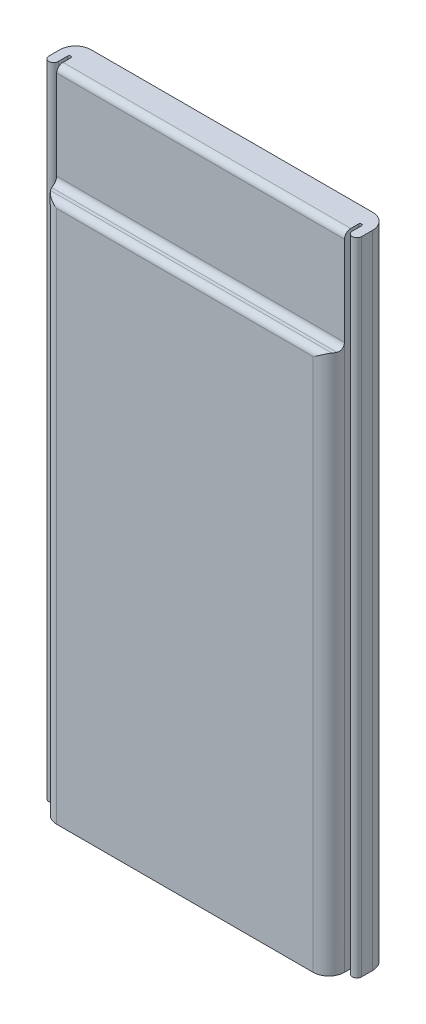
from build123d import *

# Parameters (mm, degrees)
EXTRUDE_1_DEPTH                 = 20.5
CUT_EXTRUDE_1_REACH             = 25.005
CUT_EXTRUDE_1_DIRECTION_2_REACH = 25.005


with BuildPart() as part:
    # Эскиз1 → Бобышка-Вытянуть1 (new, symmetric)
    with BuildSketch(Plane(origin=(0, 0, 0), x_dir=(1, 0, 0), z_dir=(0, 1, 0))):
        with BuildLine():
            Line((-9, 0), (9, 0))
            ThreePointArc((9, 0), (9.707106781, -0.292893219), (10, -1))
            Line((10, -1), (10, -1.7))
            ThreePointArc((10, -1.7), (9.7, -2), (9.4, -1.7))
            Line((9.4, -1.7), (9.4, -1.1))
            ThreePointArc((9.4, -1.1), (9.3, -1), (9.2, -1.1))
            Line((9.2, -1.1), (9.2, -2))
            ThreePointArc((9.2, -2), (8.907106781, -2.707106781), (8.2, -3))
            Line((8.2, -3), (-8.2, -3))
            ThreePointArc((-8.2, -3), (-8.907106781, -2.707106781), (-9.2, -2))
            Line((-9.2, -2), (-9.2, -1.1))
            ThreePointArc((-9.2, -1.1), (-9.3, -1), (-9.4, -1.1))
            Line((-9.4, -1.1), (-9.4, -1.7))
            ThreePointArc((-9.4, -1.7), (-9.7, -2), (-10, -1.7))
            Line((-10, -1.7), (-10, -1))
            ThreePointArc((-10, -1), (-9.707106781, -0.292893219), (-9, 0))
        make_face()
    extrude(amount=EXTRUDE_1_DEPTH, both=True)

    # Эскиз2 → Вырез-Вытянуть1 (cut, up to next)
    with BuildSketch(Plane(origin=(0, 0, 0), x_dir=(0, 0, -1), z_dir=(1, 0, 0)), mode=Mode.PRIVATE) as cut_extrude_1_sk1:
        with BuildLine():
            Line((-2, 20.1), (-2, 14.4))
            ThreePointArc((-2, 14.4), (-2.117157288, 14.117157288), (-2.4, 14))
            Line((-2.4, 14), (-2.6, 14))
            ThreePointArc((-2.6, 14), (-2.882842712, 13.882842712), (-3, 13.6))
            Line((-3, 13.6), (-3, 20.5))
            Line((-3, 20.5), (-1.6, 20.5))
            ThreePointArc((-1.6, 20.5), (-1.882842712, 20.382842712), (-2, 20.1))
        make_face()
    cut_extrude_1_tool1 = extrude(cut_extrude_1_sk1.sketch, amount=-CUT_EXTRUDE_1_REACH, mode=Mode.PRIVATE) & part.part
    add(cut_extrude_1_tool1.solids().sort_by_distance((0, 17.265669, 2.501219))[0], mode=Mode.SUBTRACT)

    # Эскиз2 → Вырез-Вытянуть1 direction 2 (cut, up to next)
    with BuildSketch(Plane(origin=(0, 0, 0), x_dir=(0, 0, -1), z_dir=(1, 0, 0)), mode=Mode.PRIVATE) as cut_extrude_1_direction_2_sk1:
        with BuildLine():
            Line((-2, 20.1), (-2, 14.4))
            ThreePointArc((-2, 14.4), (-2.117157288, 14.117157288), (-2.4, 14))
            Line((-2.4, 14), (-2.6, 14))
            ThreePointArc((-2.6, 14), (-2.882842712, 13.882842712), (-3, 13.6))
            Line((-3, 13.6), (-3, 20.5))
            Line((-3, 20.5), (-1.6, 20.5))
            ThreePointArc((-1.6, 20.5), (-1.882842712, 20.382842712), (-2, 20.1))
        make_face()
    cut_extrude_1_direction_2_tool1 = extrude(cut_extrude_1_direction_2_sk1.sketch, amount=CUT_EXTRUDE_1_DIRECTION_2_REACH, mode=Mode.PRIVATE) & part.part
    add(cut_extrude_1_direction_2_tool1.solids().sort_by_distance((0, 17.265669, 2.501219))[0], mode=Mode.SUBTRACT)


solid = part.part
